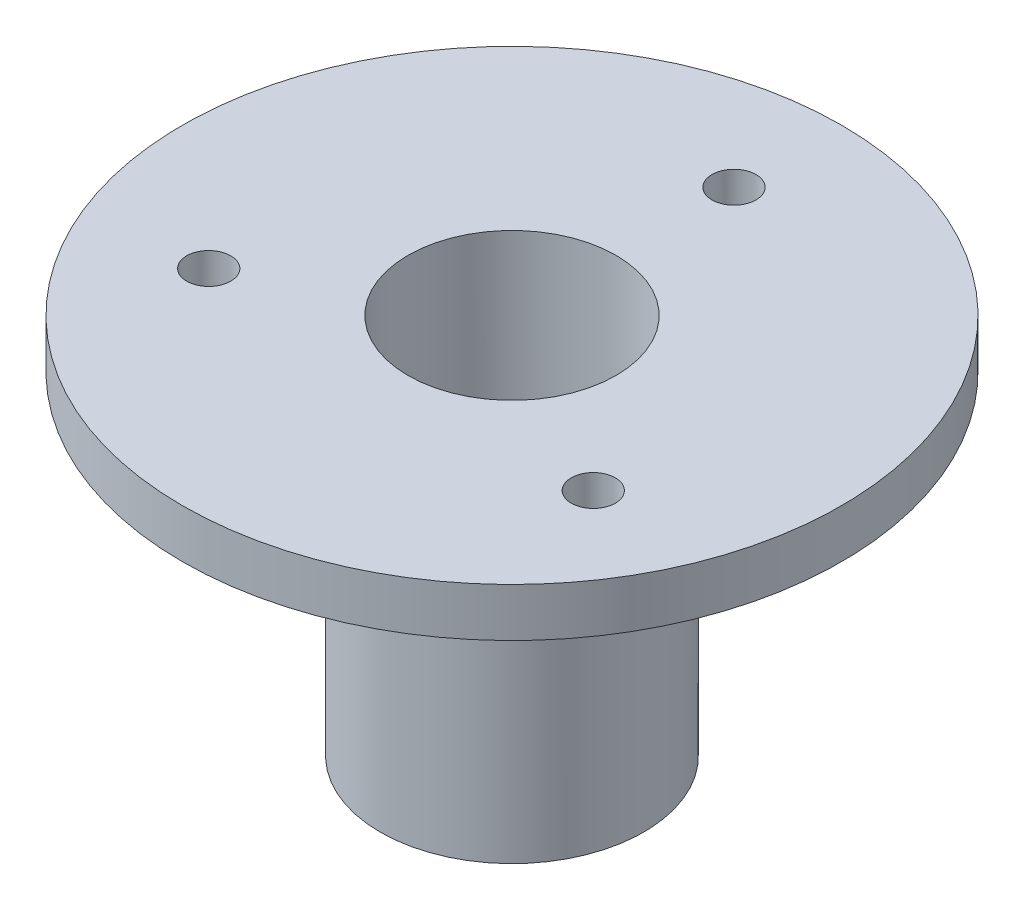
from build123d import *
from build123d.topology import SkipClean

# Parameters (mm, degrees)
CROQUIS1_R              = 47.5
CROQUIS1_R_2            = 3.175
CROQUIS1_R_3            = 15
SALIENTE_EXTRUIR1_DEPTH = 7
SALIENTE_EXTRUIR2_START = 48
CROQUIS2_R              = 19
CROQUIS2_R_2            = 15
SALIENTE_EXTRUIR2_DEPTH = 48
SALIENTE_EXTRUIR3_START = 3
CROQUIS3_R              = 7.5
CROQUIS3_R_2            = 3.175
SALIENTE_EXTRUIR3_DEPTH = 3


with BuildPart() as part:
    # Croquis1 → Saliente-Extruir1 (new body)
    with BuildSketch(Plane(origin=(0, 0, 0), x_dir=(1, 0, 0), z_dir=(0, 1, 0))):
        with Locations(Location((0, 0, 0), (0, 0, 270))):
            Circle(CROQUIS1_R)
        with Locations(Location((0, 32, 0), (0, 0, 270))):
            Circle(CROQUIS1_R_2, mode=Mode.SUBTRACT)
        with Locations(Location((27.712812921, -16, 0), (0, 0, 270))):
            Circle(CROQUIS1_R_2, mode=Mode.SUBTRACT)
        with Locations(Location((-27.712812921, -16, 0), (0, 0, 270))):
            Circle(CROQUIS1_R_2, mode=Mode.SUBTRACT)
        with Locations(Location((0, 0, 0), (0, 0, 270))):
            Circle(CROQUIS1_R_3, mode=Mode.SUBTRACT)
    extrude(amount=SALIENTE_EXTRUIR1_DEPTH)

    # Croquis2 → Saliente-Extruir2 (add)
    with SkipClean():  # the faces are left unmerged after this step: merging them gives an invalid solid
        with BuildSketch(Plane.XZ.offset(SALIENTE_EXTRUIR2_START)):
            with Locations(Location((0, 0, 0), (0, 0, 90))):
                Circle(CROQUIS2_R)
            with Locations(Location((0, 0, 0), (0, 0, 270))):
                Circle(CROQUIS2_R_2, mode=Mode.SUBTRACT)
        extrude(amount=-SALIENTE_EXTRUIR2_DEPTH)

    # Croquis3 → Saliente-Extruir3 (add)
    # profile 1 of 3: a face of its own
    with SkipClean():  # the faces are left unmerged after this step: merging them gives an invalid solid
        with BuildSketch(Plane.XZ.offset(SALIENTE_EXTRUIR3_START)):
            with Locations(Location((-27.712812921, 16, 0), (0, 0, 90))):
                Circle(CROQUIS3_R)
            with Locations(Location((-27.712812921, 16, 0), (0, 0, 270))):
                Circle(CROQUIS3_R_2, mode=Mode.SUBTRACT)
        # profile 2 of 3: a face of its own
        with BuildSketch(Plane.XZ.offset(SALIENTE_EXTRUIR3_START)):
            with Locations(Location((27.712812921, 16, 0), (0, 0, 90))):
                Circle(CROQUIS3_R)
            with Locations(Location((27.712812921, 16, 0), (0, 0, 270))):
                Circle(CROQUIS3_R_2, mode=Mode.SUBTRACT)
        # profile 3 of 3: a face of its own
        with BuildSketch(Plane.XZ.offset(SALIENTE_EXTRUIR3_START)):
            with Locations(Location((0, -32, 0), (0, 0, 90))):
                Circle(CROQUIS3_R)
            with Locations(Location((0, -32, 0), (0, 0, 270))):
                Circle(CROQUIS3_R_2, mode=Mode.SUBTRACT)
        extrude(amount=-SALIENTE_EXTRUIR3_DEPTH)


solid = part.part
